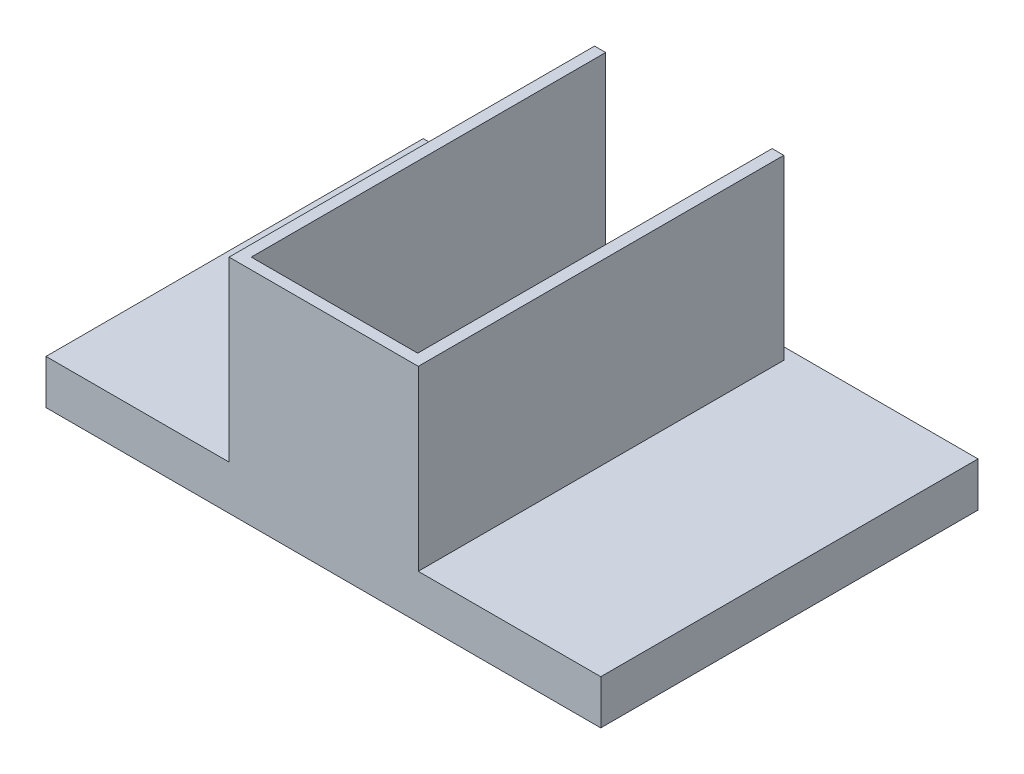
from build123d import *

# Parameters (mm, degrees)
SKETCH1_W           = 63.5
SKETCH1_H           = 21.59
BOSS_EXTRUDE1_DEPTH = 5.08
SKETCH2_W           = 19.05
SKETCH2_H           = 20.32
BOSS_EXTRUDE2_DEPTH = 1.27
SKETCH3_W           = 1.27
SKETCH3_H           = 21.59
BOSS_EXTRUDE3_DEPTH = 20.32
SKETCH4_W           = 1.336000662
SKETCH4_H           = 43.13668157
BOSS_EXTRUDE4_DEPTH = 20.32
SKETCH5_W           = 10.16
SKETCH5_H           = 20.215193183
CUT_EXTRUDE2_DEPTH  = 1.27
SKETCH6_W           = 21.656000662
SKETCH6_H           = 1.342156596
CUT_EXTRUDE3_DEPTH  = 20.32


with BuildPart() as part:
    # Sketch1 → Boss-Extrude1 (new body)
    with BuildSketch(Plane(origin=(0, 0, 0), x_dir=(1, 0, 0), z_dir=(0, 1, 0))):
        with Locations((-28.979219315, -15.643333637)):
            Rectangle(SKETCH1_W, SKETCH1_H)
    boss_extrude1 = extrude(amount=BOSS_EXTRUDE1_DEPTH)

    # Sketch2 → Boss-Extrude2 (add)
    with BuildSketch(Plane.XY.offset(26.438333637)):
        with Locations((-28.979219315, 15.24)):
            Rectangle(SKETCH2_W, SKETCH2_H)
    boss_extrude2 = extrude(amount=-BOSS_EXTRUDE2_DEPTH)

    # Sketch3 → Boss-Extrude3 (add)
    with BuildSketch(Plane(origin=(0, 5.08, 0), x_dir=(1, 0, 0), z_dir=(0, 1, 0))):
        with Locations((-39.139219315, -15.643333637)):
            Rectangle(SKETCH3_W, SKETCH3_H)
    boss_extrude3 = extrude(amount=BOSS_EXTRUDE3_DEPTH)

    # Mirror2: Boss-Extrude1, Boss-Extrude2, Boss-Extrude3 across plane
    add(boss_extrude1.mirror(Plane(origin=(-60.729219315, 5.08, 4.848333637), x_dir=(1, 0, 0), z_dir=(0, 0, 1))))
    add(boss_extrude2.mirror(Plane(origin=(-60.729219315, 5.08, 4.848333637), x_dir=(1, 0, 0), z_dir=(0, 0, 1))))
    add(boss_extrude3.mirror(Plane(origin=(-60.729219315, 5.08, 4.848333637), x_dir=(1, 0, 0), z_dir=(0, 0, 1))))

    # Sketch4 → Boss-Extrude4 (add)
    with BuildSketch(Plane(origin=(0, 5.08, 0), x_dir=(1, 0, 0), z_dir=(0, 1, 0))):
        with Locations((-18.786218984, -4.869992852)):
            Rectangle(SKETCH4_W, SKETCH4_H)
    extrude(amount=BOSS_EXTRUDE4_DEPTH)

    # Sketch5 → Cut-Extrude2 (cut)
    with BuildSketch(Plane(origin=(0, 0, -16.741666363), x_dir=(-1, 0, 0), z_dir=(0, 0, -1))):
        with Locations((29.613387645, 15.279515477)):
            Rectangle(SKETCH5_W, SKETCH5_H)
    extrude(amount=-CUT_EXTRUDE2_DEPTH, mode=Mode.SUBTRACT)

    # Sketch6 → Cut-Extrude3 (cut)
    with BuildSketch(Plane(origin=(0, 25.4, 0), x_dir=(1, 0, 0), z_dir=(0, 1, 0))):
        with Locations((-28.946218984, 16.070588065)):
            Rectangle(SKETCH6_W, SKETCH6_H)
    extrude(amount=-CUT_EXTRUDE3_DEPTH, mode=Mode.SUBTRACT)


solid = part.part
